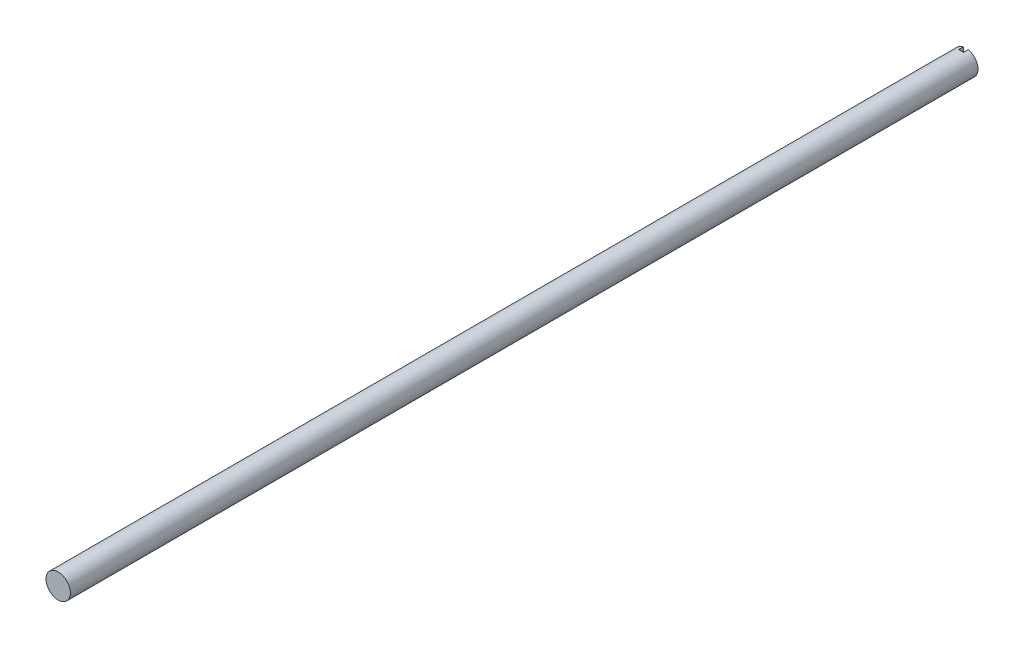
from build123d import *

# Parameters (mm, degrees)
ESQUISSE1_R             = 2.5
BOSS_EXTRU_1_DEPTH      = 186
ENL_V_MAT_EXTRU_1_DEPTH = 1


with BuildPart() as part:
    # Esquisse1 → Boss.-Extru.1 (new body)
    with BuildSketch(Plane.XY):
        with Locations(Location((0, 0, 0), (0, 0, 180))):
            Circle(ESQUISSE1_R)
    extrude(amount=BOSS_EXTRU_1_DEPTH)

    # Esquisse2 → Enlèv. mat.-Extru.1 (cut)
    with BuildSketch(Plane(origin=(0, 0, 0), x_dir=(-1, 0, 0), z_dir=(0, 0, -1))):
        with BuildLine():
            Line((-0.5, 2.449489743), (-0.5, -2.449489743))
            ThreePointArc((-0.5, -2.449489743), (0, -2.5), (0.5, -2.449489743))
            Line((0.5, -2.449489743), (0.5, 2.449489743))
            ThreePointArc((0.5, 2.449489743), (0, 2.5), (-0.5, 2.449489743))
        make_face()
    extrude(amount=-ENL_V_MAT_EXTRU_1_DEPTH, mode=Mode.SUBTRACT)


solid = part.part
